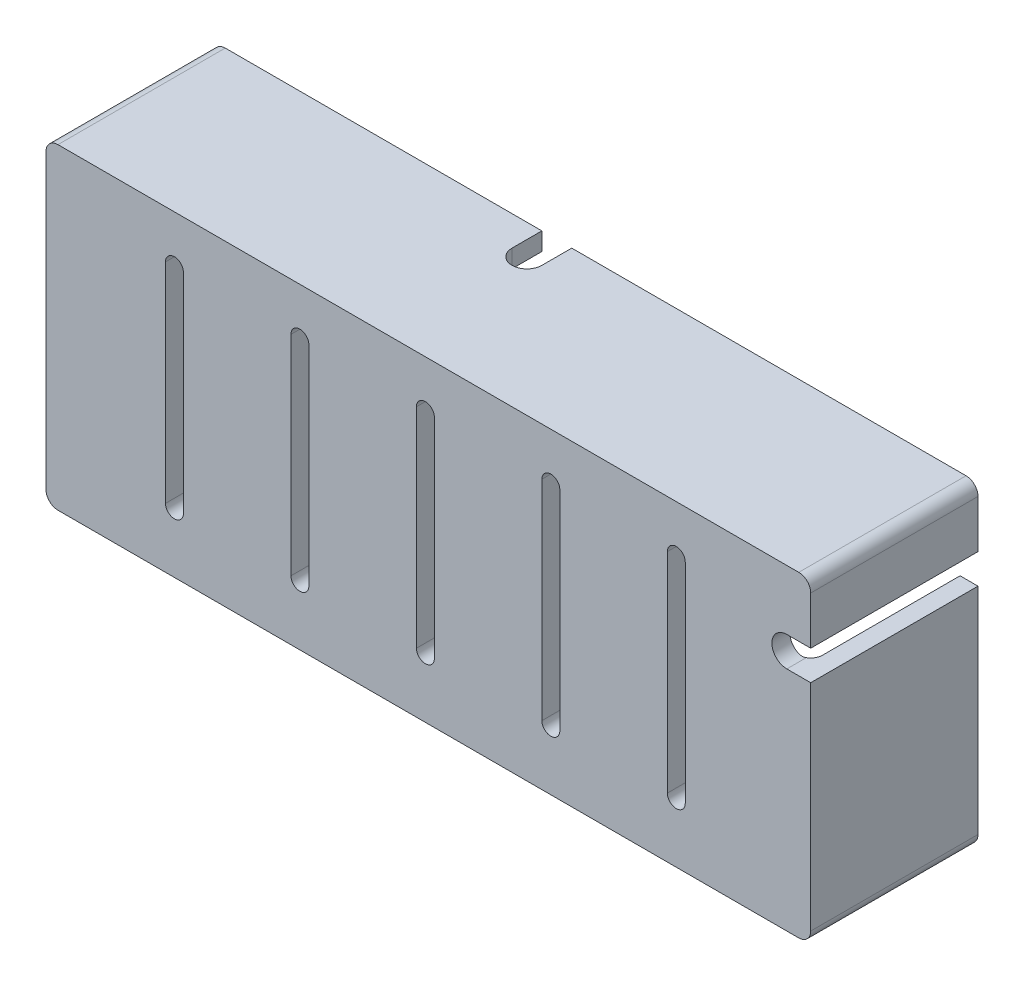
from build123d import *

# Parameters (mm, degrees)
ESQUISSE1_W             = 128
ESQUISSE1_H             = 53
ESQUISSE1_W_2           = 122
ESQUISSE1_H_2           = 47
BOSS_EXTRU_1_DEPTH      = 25
ESQUISSE2_W             = 128
ESQUISSE2_H             = 53
BOSS_EXTRU_2_DEPTH      = 3
BOSS_EXTRU_3_DEPTH      = 25
ENL_V_MAT_EXTRU_1_DEPTH = 3
ESQUISSE5_R             = 1
ENL_V_MAT_EXTRU_2_DEPTH = 20
CONG_1_R                = 5
CONG_2_R                = 5
ESQUISSE6_W             = 28
ESQUISSE6_H             = 5
ENL_V_MAT_EXTRU_3_DEPTH = 3
ENL_V_MAT_EXTRU_4_DEPTH = 8
ENL_V_MAT_EXTRU_6_DEPTH = 8
ENL_V_MAT_EXTRU_7_DEPTH = 8
ESQUISSE13_W            = 2
ESQUISSE13_H            = 6
ENL_V_MAT_EXTRU_8_DEPTH = 3
CONG_4_R                = 2
CONG_5_R                = 2


with BuildPart() as part:
    # Esquisse1 → Boss.-Extru.1 (new body)
    with BuildSketch(Plane.XY):
        Rectangle(ESQUISSE1_W, ESQUISSE1_H)
        Rectangle(ESQUISSE1_W_2, ESQUISSE1_H_2, mode=Mode.SUBTRACT)
    extrude(amount=BOSS_EXTRU_1_DEPTH)

    # Esquisse2 → Boss.-Extru.2 (add)
    with BuildSketch(Plane.XY.offset(25)):
        Rectangle(ESQUISSE2_W, ESQUISSE2_H)
    extrude(amount=BOSS_EXTRU_2_DEPTH)

    # Esquisse3 → Boss.-Extru.3 (add)
    with BuildSketch(Plane(origin=(0, 0, 25), x_dir=(-1, 0, 0), z_dir=(0, 0, -1))):
        Polygon((61, 23.5), (56, 23.5), (61, 18.5), align=None)
        Polygon((61, -23.5), (61, -18.5), (56, -23.5), align=None)
        Polygon((-61, -23.5), (-61, -18.5), (-56, -23.5), align=None)
        Polygon((-61, 18.5), (-56, 23.5), (-61, 23.5), align=None)
    extrude(amount=BOSS_EXTRU_3_DEPTH)

    # Esquisse4 → Enlèv. mat.-Extru.1 (cut)
    with BuildSketch(Plane.XY.offset(28)):
        with BuildLine():
            Line((-44, 18.5), (-44, -16.5))
            ThreePointArc((-44, -16.5), (-42.5, -18), (-41, -16.5))
            Line((-41, -16.5), (-41, 18.5))
            ThreePointArc((-41, 18.5), (-42.5, 20), (-44, 18.5))
        make_face()
        with BuildLine():
            Line((-23, 18.5), (-23, -16.5))
            ThreePointArc((-23, -16.5), (-21.5, -18), (-20, -16.5))
            Line((-20, -16.5), (-20, 18.5))
            ThreePointArc((-20, 18.5), (-21.5, 20), (-23, 18.5))
        make_face()
        with BuildLine():
            Line((-2, 18.5), (-2, -16.5))
            ThreePointArc((-2, -16.5), (-0.5, -18), (1, -16.5))
            Line((1, -16.5), (1, 18.5))
            ThreePointArc((1, 18.5), (-0.5, 20), (-2, 18.5))
        make_face()
        with BuildLine():
            Line((19, 18.5), (19, -16.5))
            ThreePointArc((19, -16.5), (20.5, -18), (22, -16.5))
            Line((22, -16.5), (22, 18.5))
            ThreePointArc((22, 18.5), (20.5, 20), (19, 18.5))
        make_face()
        with BuildLine():
            Line((40, 18.5), (40, -16.5))
            ThreePointArc((40, -16.5), (41.5, -18), (43, -16.5))
            Line((43, -16.5), (43, 18.5))
            ThreePointArc((43, 18.5), (41.5, 20), (40, 18.5))
        make_face()
    extrude(amount=-ENL_V_MAT_EXTRU_1_DEPTH, mode=Mode.SUBTRACT)

    # Esquisse5 → Enlèv. mat.-Extru.2 (cut)
    with BuildSketch(Plane(origin=(0, 0, 0), x_dir=(-1, 0, 0), z_dir=(0, 0, -1))):
        with Locations((-60.621320344, 23.121320344)):
            Circle(ESQUISSE5_R)
        with Locations((60.621320344, 23.121320344)):
            Circle(ESQUISSE5_R)
        with Locations((-60.621320344, -23.121320344)):
            Circle(ESQUISSE5_R)
        with Locations((60.621320344, -23.121320344)):
            Circle(ESQUISSE5_R)
    extrude(amount=-ENL_V_MAT_EXTRU_2_DEPTH, mode=Mode.SUBTRACT)

    # Congé1
    cong_1_edges = [part.edges().sort_by_distance(p)[0] for p in [
        (56, 23.5, 12.5),
    ]]
    fillet(cong_1_edges, radius=CONG_1_R)

    # Congé2
    cong_2_edges = [part.edges().sort_by_distance(p)[0] for p in [
        (-56, 23.5, 12.5),
        (-61, 18.5, 12.5),
        (-56, -23.5, 12.5),
        (-61, -18.5, 12.5),
        (56, -23.5, 12.5),
        (61, -18.5, 12.5),
        (61, 18.5, 12.5),
    ]]
    fillet(cong_2_edges, radius=CONG_2_R)

    # Esquisse6 → Enlèv. mat.-Extru.3 (cut)
    with BuildSketch(Plane(origin=(64, 0, 0), x_dir=(0, 0, -1), z_dir=(1, 0, 0))):
        with Locations((-14, 14)):
            Rectangle(ESQUISSE6_W, ESQUISSE6_H)
    extrude(amount=-ENL_V_MAT_EXTRU_3_DEPTH, mode=Mode.SUBTRACT)

    # Esquisse7 → Enlèv. mat.-Extru.4 (cut)
    with BuildSketch(Plane(origin=(0, 26.5, 0), x_dir=(1, 0, 0), z_dir=(0, 1, 0))):
        with BuildLine():
            Line((-9, 0), (-4, 0))
            Line((-4, 0), (-4, -5))
            ThreePointArc((-4, -5), (-6.5, -7.5), (-9, -5))
            Line((-9, -5), (-9, 0))
        make_face()
    extrude(amount=-ENL_V_MAT_EXTRU_4_DEPTH, mode=Mode.SUBTRACT)

    # Esquisse9 → Enlèv. mat.-Extru.6 (cut)
    with BuildSketch(Plane.XZ.offset(26.5)):
        with BuildLine():
            Line((44, 0), (49, 0))
            Line((49, 0), (49, 5))
            ThreePointArc((49, 5), (46.5, 7.5), (44, 5))
            Line((44, 5), (44, 0))
        make_face()
    extrude(amount=-ENL_V_MAT_EXTRU_6_DEPTH, mode=Mode.SUBTRACT)

    # Esquisse10 → Enlèv. mat.-Extru.7 (cut)
    with BuildSketch(Plane.XY.offset(28)):
        with BuildLine():
            Line((61, 16.5), (60, 16.5))
            ThreePointArc((60, 16.5), (57.5, 14), (60, 11.5))
            Line((60, 11.5), (61, 11.5))
            Line((61, 11.5), (61, 16.5))
        make_face()
    extrude(amount=-ENL_V_MAT_EXTRU_7_DEPTH, mode=Mode.SUBTRACT)

    # Esquisse13 → Enlèv. mat.-Extru.8 (cut)
    with BuildSketch(Plane.ZY.offset(64)):
        with Locations((1, 0)):
            Rectangle(ESQUISSE13_W, ESQUISSE13_H)
    extrude(amount=-ENL_V_MAT_EXTRU_8_DEPTH, mode=Mode.SUBTRACT)

    # Congé4
    cong_4_edges = [part.edges().sort_by_distance(p)[0] for p in [
        (60.60568242, 18.375130905, 25),
        (58.5, 21, 25),
        (55.84234935, 23.119397663, 25),
        (61, -2.464466094, 25),
        (60.619397663, -18.34234935, 25),
        (58.5, -21, 25),
        (55.84234935, -23.119397663, 25),
        (0, -23.5, 25),
        (-55.84234935, -23.119397663, 25),
        (-58.5, -21, 25),
        (-60.619397663, -18.34234935, 25),
        (-61, 0, 25),
        (-60.619397663, 18.34234935, 25),
        (-58.5, 21, 25),
        (-55.84234935, 23.119397663, 25),
        (0, 23.5, 25),
    ]]
    fillet(cong_4_edges, radius=CONG_4_R)

    # Congé5
    cong_5_edges = [part.edges().sort_by_distance(p)[0] for p in [
        (-64, 26.5, 14),
        (64, 26.5, 14),
        (64, -26.5, 14),
        (-64, -26.5, 14),
    ]]
    fillet(cong_5_edges, radius=CONG_5_R)


solid = part.part
